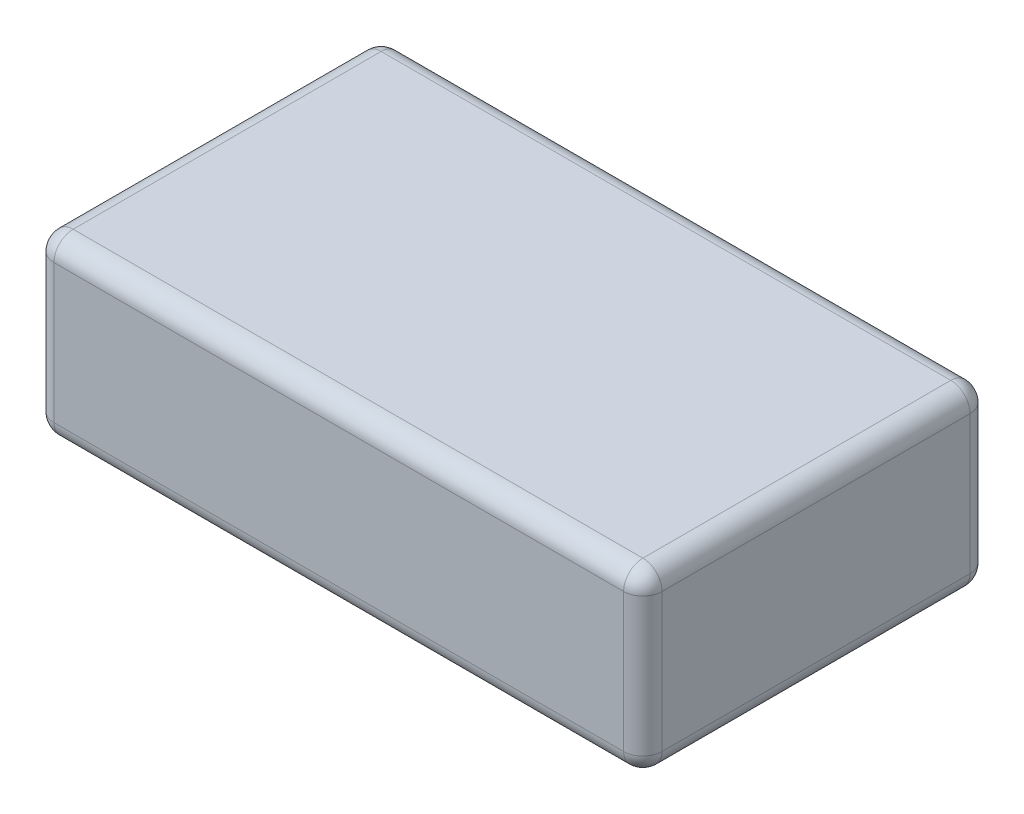
from build123d import *

# Parameters (mm, degrees)
SKETCH1_W           = 158
SKETCH1_H           = 90
BOSS_EXTRUDE1_DEPTH = 46
FILLET2_R           = 5


with BuildPart() as part:
    # Sketch1 → Boss-Extrude1 (new body)
    with BuildSketch(Plane(origin=(0, 0, 0), x_dir=(1, 0, 0), z_dir=(0, 1, 0))):
        with Locations((79, 45)):
            Rectangle(SKETCH1_W, SKETCH1_H)
    extrude(amount=BOSS_EXTRUDE1_DEPTH)

    # Fillet2
    fillet2_edges = [part.edges().sort_by_distance(p)[0] for p in [
        (158, 46, -45),
        (79, 46, -90),
        (0, 46, -45),
        (79, 0, -90),
        (158, 0, -45),
        (79, 0, 0),
        (0, 0, -45),
        (79, 46, 0),
        (0, 23, -90),
        (158, 23, -90),
        (158, 23, 0),
        (0, 23, 0),
    ]]
    fillet(fillet2_edges, radius=FILLET2_R)


solid = part.part
